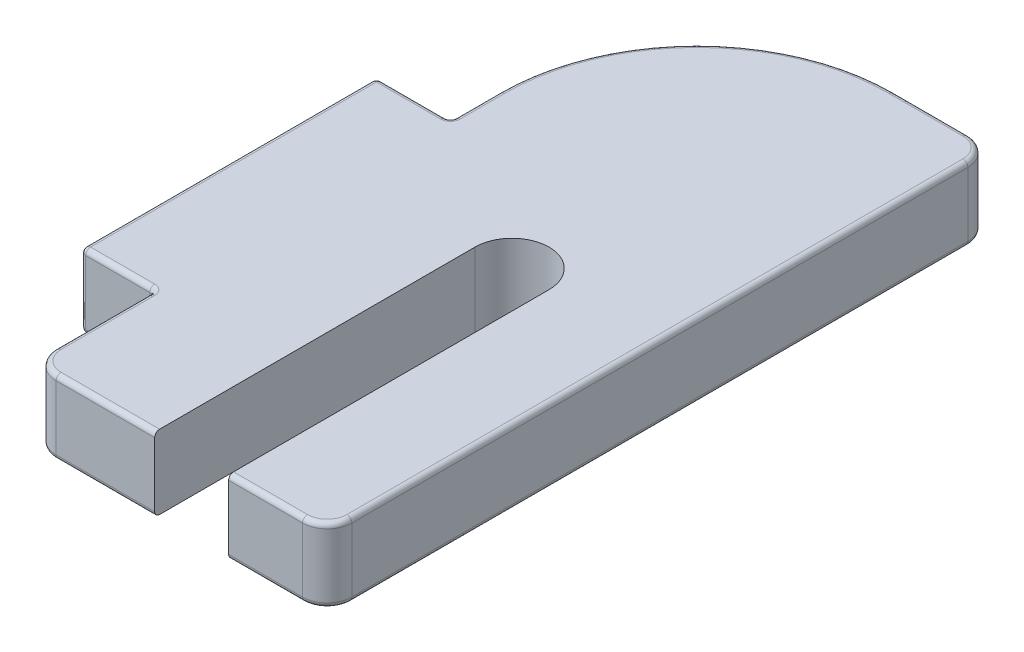
from build123d import *

# Parameters (mm, degrees)
BOSS_EXTRUDE1_DEPTH = 3
FILLET1_R           = 0.2


with BuildPart() as part:
    # Sketch1 → Boss-Extrude1 (new body)
    with BuildSketch(Plane(origin=(0, 0, 0), x_dir=(1, 0, 0), z_dir=(0, 1, 0))):
        with BuildLine():
            Line((-1.5, 0), (-1.5, -13))
            Line((-1.5, -13), (-5.5, -13))
            ThreePointArc((-5.5, -13), (-6.207106781, -12.707106781), (-6.5, -12))
            Line((-6.5, -12), (-6.5, -8))
            Line((-6.5, -8), (-9.5, -8))
            Line((-9.5, -8), (-9.5, 4))
            Line((-9.5, 4), (-6.5, 4))
            Line((-6.5, 4), (-6.5, 6))
            ThreePointArc((-6.5, 6), (-4.156854249, 11.656854249), (1.5, 14))
            Line((1.5, 14), (4.5, 14))
            ThreePointArc((4.5, 14), (5.207106781, 13.707106781), (5.5, 13))
            Line((5.5, 13), (5.5, -12))
            ThreePointArc((5.5, -12), (5.207106781, -12.707106781), (4.5, -13))
            Line((4.5, -13), (1.5, -13))
            Line((1.5, -13), (1.5, 0))
            ThreePointArc((1.5, 0), (0, 1.5), (-1.5, 0))
        make_face()
    extrude(amount=BOSS_EXTRUDE1_DEPTH)

    # Fillet1
    fillet1_edges = [part.edges().sort_by_distance(p)[0] for p in [
        (-8, 3, -4),
        (-9.5, 3, 2),
        (3, 0, -14),
        (5.207106781, 0, -13.707106781),
        (5.5, 0, -0.5),
        (5.207106781, 0, 12.707106781),
        (3, 0, 13),
        (-8, 3, 8),
        (-3.5, 0, 13),
        (-6.207106781, 0, 12.707106781),
        (-6.5, 0, 10),
        (-8, 0, 8),
        (-9.5, 0, 2),
        (-6.5, 3, 10),
        (-8, 0, -4),
        (-6.5, 0, -5),
        (-4.156854249, 0, -11.656854249),
        (-6.207106781, 3, 12.707106781),
        (-3.5, 3, 13),
        (-6.5, 1.5, 8),
        (-9.5, 1.5, 8),
        (-9.5, 1.5, -4),
        (-6.5, 1.5, -4),
        (3, 3, 13),
        (-4.156854249, 3, -11.656854249),
        (5.207106781, 3, 12.707106781),
        (5.5, 3, -0.5),
        (5.207106781, 3, -13.707106781),
        (3, 3, -14),
        (-6.5, 3, -5),
    ]]
    fillet(fillet1_edges, radius=FILLET1_R)


solid = part.part
